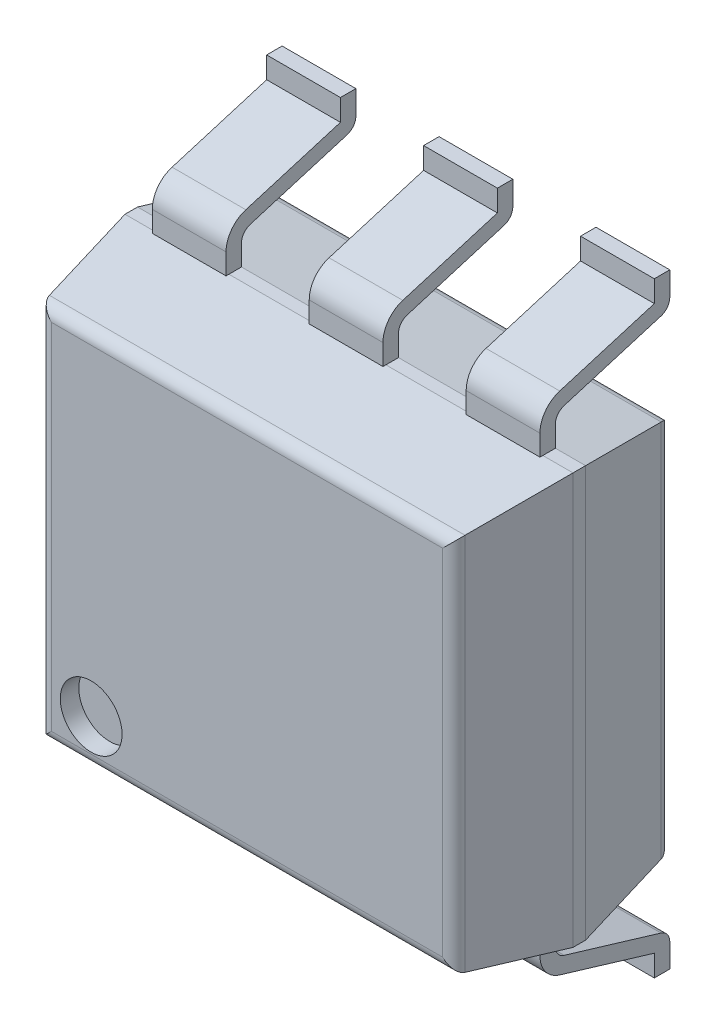
from build123d import *
from OCP.BRepFilletAPI import BRepFilletAPI_MakeChamfer

# Parameters (mm, degrees)
SKETCH1_W                = 7.25
SKETCH1_H                = 6.65
BASE_EXTRUDE_DEPTH       = 3.5052
CHAMFER1_SIZE            = 1.651
CHAMFER1_SIZE2           = 0.291115845
CHAMFER2_SIZE            = 1.651
CHAMFER2_SIZE2           = 0.291115845
SKETCH3_R                = 0.5
CUT_EXTRUDE1_DEPTH       = 0.3
BOSS_EXTRUDE_THIN3_DEPTH = 0.5969
LPATTERN1_COUNT          = 3
LPATTERN1_PITCH          = 2.54
MIRROR1_COPY_1_DEPTH     = 0.5969
MIRROR1_COPY_2_DEPTH     = 0.5969
FILLET_1_R               = 0.2


with BuildPart() as part:
    # Sketch1 → Base-Extrude (new body)
    with BuildSketch(Plane.XY):
        with Locations((2.99, 4.214)):
            Rectangle(SKETCH1_W, SKETCH1_H)
    extrude(amount=BASE_EXTRUDE_DEPTH)

    # Chamfer1: one chamfer whose edges measure the first distance from different faces: ONE call of the kernel's chamfer builder (chamfer() names one face for all edges)
    chamfer1_edges_1 = [part.edges().sort_by_distance(p)[0] for p in [
        (6.615, 4.214, 3.5052),
    ]]
    chamfer1_side_1 = [part.faces().sort_by_distance(p)[0] for p in [
        (6.615, 4.214, 1.7526),
    ]]
    chamfer1_edges_2 = [part.edges().sort_by_distance(p)[0] for p in [
        (2.99, 7.539, 3.5052),
    ]]
    chamfer1_side_2 = [part.faces().sort_by_distance(p)[0] for p in [
        (2.99, 7.539, 1.7526),
    ]]
    chamfer1_edges_3 = [part.edges().sort_by_distance(p)[0] for p in [
        (-0.635, 4.214, 3.5052),
    ]]
    chamfer1_side_3 = [part.faces().sort_by_distance(p)[0] for p in [
        (-0.635, 4.214, 1.7526),
    ]]
    chamfer1_edges_4 = [part.edges().sort_by_distance(p)[0] for p in [
        (2.99, 0.889, 3.5052),
    ]]
    chamfer1_side_4 = [part.faces().sort_by_distance(p)[0] for p in [
        (2.99, 0.889, 1.7526),
    ]]
    chamfer1 = BRepFilletAPI_MakeChamfer(part.part.solid().wrapped)
    for e in chamfer1_edges_1:
        chamfer1.Add(CHAMFER1_SIZE, CHAMFER1_SIZE2, e.wrapped, chamfer1_side_1[0].wrapped)  # the first distance lies on this face
    for e in chamfer1_edges_2:
        chamfer1.Add(CHAMFER1_SIZE, CHAMFER1_SIZE2, e.wrapped, chamfer1_side_2[0].wrapped)  # the first distance lies on this face
    for e in chamfer1_edges_3:
        chamfer1.Add(CHAMFER1_SIZE, CHAMFER1_SIZE2, e.wrapped, chamfer1_side_3[0].wrapped)  # the first distance lies on this face
    for e in chamfer1_edges_4:
        chamfer1.Add(CHAMFER1_SIZE, CHAMFER1_SIZE2, e.wrapped, chamfer1_side_4[0].wrapped)  # the first distance lies on this face
    add(Compound.cast(chamfer1.Shape()), mode=Mode.REPLACE)

    # Chamfer2: one chamfer whose edges measure the first distance from different faces: ONE call of the kernel's chamfer builder (chamfer() names one face for all edges)
    chamfer2_edges_1 = [part.edges().sort_by_distance(p)[0] for p in [
        (2.99, 7.539, 0),
    ]]
    chamfer2_side_1 = [part.faces().sort_by_distance(p)[0] for p in [
        (2.99, 7.539, 0.9271),
    ]]
    chamfer2_edges_2 = [part.edges().sort_by_distance(p)[0] for p in [
        (6.615, 4.214, 0),
    ]]
    chamfer2_side_2 = [part.faces().sort_by_distance(p)[0] for p in [
        (6.615, 4.214, 0.9271),
    ]]
    chamfer2_edges_3 = [part.edges().sort_by_distance(p)[0] for p in [
        (2.99, 0.889, 0),
    ]]
    chamfer2_side_3 = [part.faces().sort_by_distance(p)[0] for p in [
        (2.99, 0.889, 0.9271),
    ]]
    chamfer2_edges_4 = [part.edges().sort_by_distance(p)[0] for p in [
        (-0.635, 4.214, 0),
    ]]
    chamfer2_side_4 = [part.faces().sort_by_distance(p)[0] for p in [
        (-0.635, 4.214, 0.9271),
    ]]
    chamfer2 = BRepFilletAPI_MakeChamfer(part.part.solid().wrapped)
    for e in chamfer2_edges_1:
        chamfer2.Add(CHAMFER2_SIZE, CHAMFER2_SIZE2, e.wrapped, chamfer2_side_1[0].wrapped)  # the first distance lies on this face
    for e in chamfer2_edges_2:
        chamfer2.Add(CHAMFER2_SIZE, CHAMFER2_SIZE2, e.wrapped, chamfer2_side_2[0].wrapped)  # the first distance lies on this face
    for e in chamfer2_edges_3:
        chamfer2.Add(CHAMFER2_SIZE, CHAMFER2_SIZE2, e.wrapped, chamfer2_side_3[0].wrapped)  # the first distance lies on this face
    for e in chamfer2_edges_4:
        chamfer2.Add(CHAMFER2_SIZE, CHAMFER2_SIZE2, e.wrapped, chamfer2_side_4[0].wrapped)  # the first distance lies on this face
    add(Compound.cast(chamfer2.Shape()), mode=Mode.REPLACE)

    # Sketch3 → Cut-Extrude1 (cut)
    with BuildSketch(Plane(origin=(0.118935742, 0.142956615, 3.5052), x_dir=(1, 0, 0), z_dir=(0, 0, 1))):
        with Locations((0.349775267, 1.734053999)):
            Circle(SKETCH3_R)
    extrude(amount=-CUT_EXTRUDE1_DEPTH, mode=Mode.SUBTRACT)

    # Sketch4 → Boss-Extrude-Thin3 (add, symmetric)
    with BuildSketch(Plane.ZY.offset(-0.45)):
        with BuildLine():
            Line((1.651, 0.889), (1.651, 0.552741678))
            ThreePointArc((1.651, 0.552741678), (1.61148335, 0.433388864), (1.508549057, 0.361200283))
            Line((1.508549057, 0.361200283), (-0.057549057, -0.109337536))
            ThreePointArc((-0.057549057, -0.109337536), (-0.16048335, -0.181526117), (-0.2, -0.300878931))
            Line((-0.2, -0.300878931), (-0.2, -0.686))
            Line((-0.2, -0.686), (0.05, -0.686))
            Line((0.05, -0.686), (0.05, -0.33806435))
            Line((0.05, -0.33806435), (1.580485379, 0.121773539))
            ThreePointArc((1.580485379, 0.121773539), (1.812087538, 0.284197846), (1.901, 0.552741678))
            Line((1.901, 0.552741678), (1.901, 0.889))
            Line((1.901, 0.889), (1.651, 0.889))
        make_face()
    boss_extrude_thin3 = extrude(amount=BOSS_EXTRUDE_THIN3_DEPTH, both=True)

    # LPattern1: Boss-Extrude-Thin3 ×3
    with Locations(*[(i * LPATTERN1_PITCH, 0, 0) for i in range(1, LPATTERN1_COUNT)]):
        add(boss_extrude_thin3)

    # Mirror1: Boss-Extrude-Thin3 across plane
    add(boss_extrude_thin3.mirror(Plane(origin=(0, 4.214, 0), x_dir=(0, 0, 1), z_dir=(0, -1, 0))))

    # Mirror1 copy 1 sketch → Mirror1 copy 1 (add, symmetric)
    with BuildSketch(Plane(origin=(2.99, 8.428, 0), x_dir=(0, 0, 1), z_dir=(-1, 0, 0))):
        with BuildLine():
            Line((1.651, -0.889), (1.651, -0.552741678))
            ThreePointArc((1.651, -0.552741678), (1.61148335, -0.433388864), (1.508549057, -0.361200283))
            Line((1.508549057, -0.361200283), (-0.057549057, 0.109337536))
            ThreePointArc((-0.057549057, 0.109337536), (-0.16048335, 0.181526117), (-0.2, 0.300878931))
            Line((-0.2, 0.300878931), (-0.2, 0.686))
            Line((-0.2, 0.686), (0.05, 0.686))
            Line((0.05, 0.686), (0.05, 0.33806435))
            Line((0.05, 0.33806435), (1.580485379, -0.121773539))
            ThreePointArc((1.580485379, -0.121773539), (1.812087538, -0.284197846), (1.901, -0.552741678))
            Line((1.901, -0.552741678), (1.901, -0.889))
            Line((1.901, -0.889), (1.651, -0.889))
        make_face()
    extrude(amount=MIRROR1_COPY_1_DEPTH, both=True)

    # Mirror1 copy 2 sketch → Mirror1 copy 2 (add, symmetric)
    with BuildSketch(Plane(origin=(5.53, 8.428, 0), x_dir=(0, 0, 1), z_dir=(-1, 0, 0))):
        with BuildLine():
            Line((1.651, -0.889), (1.651, -0.552741678))
            ThreePointArc((1.651, -0.552741678), (1.61148335, -0.433388864), (1.508549057, -0.361200283))
            Line((1.508549057, -0.361200283), (-0.057549057, 0.109337536))
            ThreePointArc((-0.057549057, 0.109337536), (-0.16048335, 0.181526117), (-0.2, 0.300878931))
            Line((-0.2, 0.300878931), (-0.2, 0.686))
            Line((-0.2, 0.686), (0.05, 0.686))
            Line((0.05, 0.686), (0.05, 0.33806435))
            Line((0.05, 0.33806435), (1.580485379, -0.121773539))
            ThreePointArc((1.580485379, -0.121773539), (1.812087538, -0.284197846), (1.901, -0.552741678))
            Line((1.901, -0.552741678), (1.901, -0.889))
            Line((1.901, -0.889), (1.651, -0.889))
        make_face()
    extrude(amount=MIRROR1_COPY_2_DEPTH, both=True)

    # Скругление1
    fillet_1_edges = [part.edges().sort_by_distance(p)[0] for p in [
        (-0.343884155, 4.214, 3.5052),
        (2.99, 7.247884155, 3.5052),
        (6.323884155, 4.214, 3.5052),
        (2.99, 1.180115845, 3.5052),
        (-0.343884155, 4.214, 0),
        (2.99, 7.247884155, 0),
        (6.323884155, 4.214, 0),
        (2.99, 1.180115845, 0),
    ]]
    fillet(fillet_1_edges, radius=FILLET_1_R)


solid = part.part
